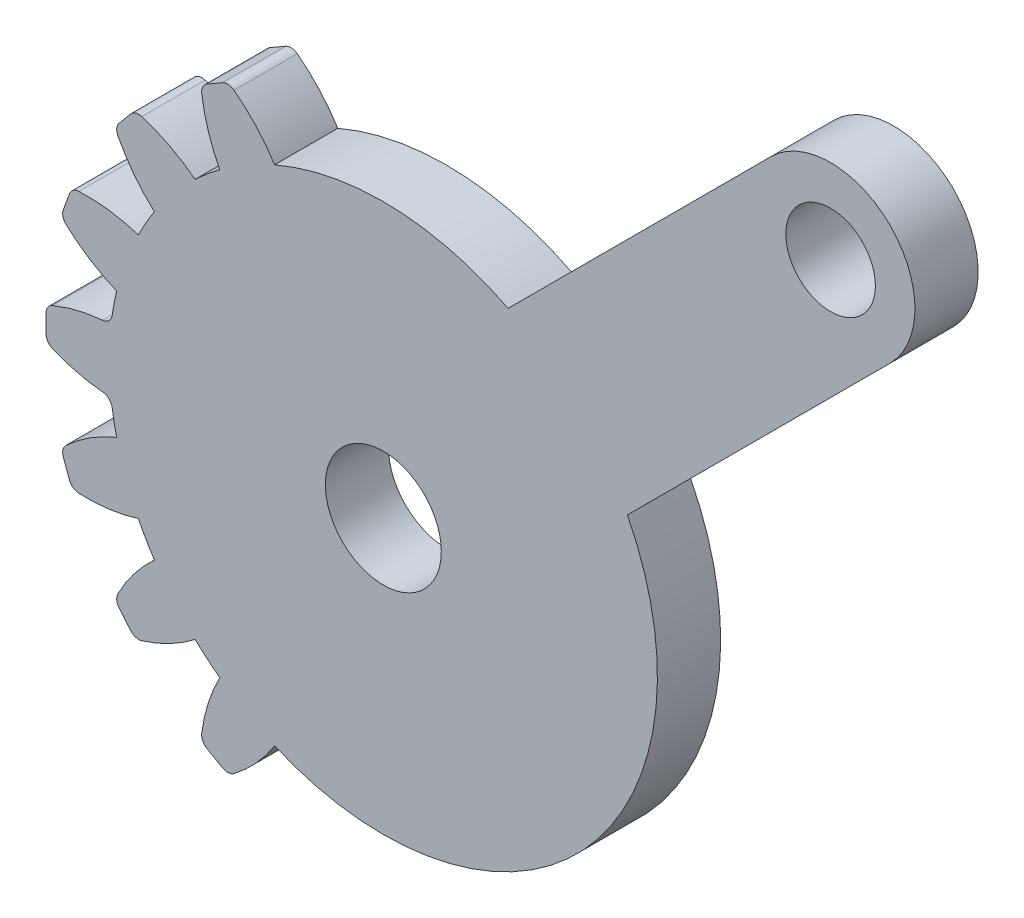
from build123d import *

# Parameters (mm, degrees)
SKETCH1_R           = 13
SKETCH1_R_2         = 2.75
BOSS_EXTRUDE1_DEPTH = 3
BOSS_EXTRUDE2_START = -3
BOSS_EXTRUDE2_DEPTH = 3
FILLET1_R           = 0.5
CIRPATTERN1_COUNT   = 4
CIRPATTERN1_ANGLE   = 60
CIRPATTERN2_COUNT   = 4
CIRPATTERN2_ANGLE   = 60
SKETCH3_R           = 2.125
BOSS_EXTRUDE3_DEPTH = 3
FILLET2_R           = 0.5


with BuildPart() as part:
    # Sketch1 → Boss-Extrude1 (new body)
    with BuildSketch(Plane.XY):
        with Locations((43.95, -5.65)):
            Circle(SKETCH1_R)
        with Locations((43.95, -5.65)):
            Circle(SKETCH1_R_2, mode=Mode.SUBTRACT)
    extrude(amount=BOSS_EXTRUDE1_DEPTH)

    # Sketch2 → Boss-Extrude2 (add)
    with BuildSketch(Plane.XY.offset(3).offset(BOSS_EXTRUDE2_START)):
        with BuildLine():
            Line((27.95, -4.9), (27.95, -6.4))
            ThreePointArc((27.95, -6.4), (29.455813765, -6.929754851), (31.03682843, -7.15))
            ThreePointArc((31.03682843, -7.15), (30.95, -5.65), (31.03682843, -4.15))
            ThreePointArc((31.03682843, -4.15), (29.455813765, -4.370245149), (27.95, -4.9))
        make_face()
    boss_extrude2 = extrude(amount=BOSS_EXTRUDE2_DEPTH)

    # Fillet1
    fillet1_edges = [part.edges().sort_by_distance(p)[0] for p in [
        (31.03682843, -7.15, 1.5),
        (27.95, -6.4, 1.5),
        (27.95, -4.9, 1.5),
        (31.03682843, -4.15, 1.5),
    ]]
    fillet(fillet1_edges, radius=FILLET1_R)

    # CirPattern1: Boss-Extrude2 ×4 about axis
    cirpattern1_axis = Axis((43.95, -5.65, 0), (0, 0, -1))
    for i in range(1, CIRPATTERN1_COUNT):
        add(boss_extrude2.rotate(cirpattern1_axis, i * CIRPATTERN1_ANGLE / (CIRPATTERN1_COUNT - 1)))

    # CirPattern2: Boss-Extrude2 ×4 about axis
    cirpattern2_axis = Axis((43.95, -5.65, 0), (0, 0, 1))
    for i in range(1, CIRPATTERN2_COUNT):
        add(boss_extrude2.rotate(cirpattern2_axis, i * CIRPATTERN2_ANGLE / (CIRPATTERN2_COUNT - 1)))

    # Sketch3 → Boss-Extrude3 (add)
    with BuildSketch(Plane.XY.offset(3)):
        with BuildLine():
            Line((44.46969592, 0.52655017), (62.334776311, 18.39163056))
            ThreePointArc((62.334776311, 18.39163056), (67.99163056, 18.39163056), (67.99163056, 12.734776311))
            Line((67.99163056, 12.734776311), (50.518308298, -4.738545951))
            Line((50.518308298, -4.738545951), (44.46969592, 0.52655017))
        make_face()
        with Locations((65.163203436, 15.563203436)):
            Circle(SKETCH3_R, mode=Mode.SUBTRACT)
    extrude(amount=-BOSS_EXTRUDE3_DEPTH)

    # Fillet2
    fillet2_edges = [part.edges().sort_by_distance(p)[0] for p in [
        (36.599519053, -19.881406461, 1.5),
        (35.300480947, -19.131406461, 1.5),
        (28.65840296, -0.882447172, 1.5),
        (29.171433175, 0.527091759, 1.5),
        (31.211198203, 4.060068423, 1.5),
        (32.175379617, 5.209135087, 1.5),
        (35.300480947, 7.831406461, 1.5),
        (36.599519053, 8.581406461, 1.5),
        (29.171433175, -11.827091759, 1.5),
        (28.65840296, -10.417552828, 1.5),
        (32.175379617, -16.509135087, 1.5),
        (31.211198203, -15.360068423, 1.5),
    ]]
    fillet(fillet2_edges, radius=FILLET2_R)


solid = part.part
